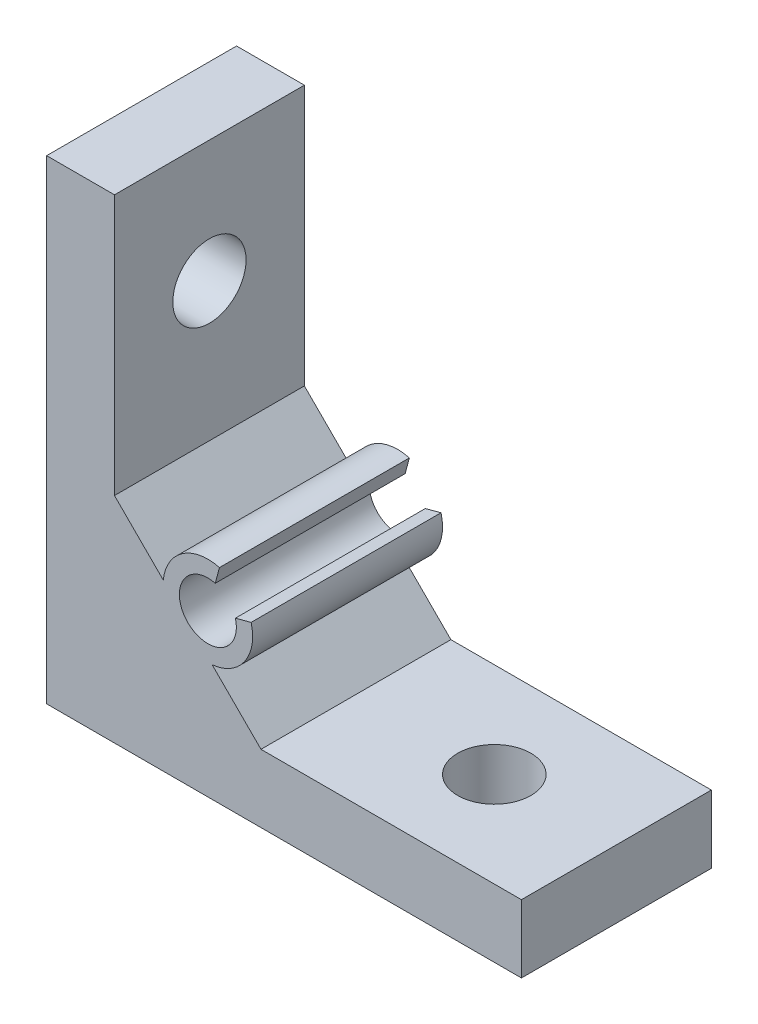
from build123d import *

# Parameters (mm, degrees)
BOSS_EXTRUDE1_DEPTH = 7
SKETCH3_R           = 2.7
CUT_EXTRUDE1_DEPTH  = 47.626172907
SKETCH4_R           = 2.7
CUT_EXTRUDE2_DEPTH  = 47.626172907


with BuildPart() as part:
    # Sketch1 → Boss-Extrude1 (new, symmetric)
    with BuildSketch(Plane.XY):
        with BuildLine():
            Line((0, 35), (0, 0))
            Line((0, 0), (35, 0))
            Line((35, 0), (35, 5))
            Line((35, 5), (15.8, 5))
            Line((15.8, 5), (12.2, 8.6))
            ThreePointArc((12.2, 8.6), (14.596011157, 10.003433414), (15.072479467, 12.739027089))
            Line((15.072479467, 12.739027089), (13.913368476, 12.428444235))
            ThreePointArc((13.913368476, 12.428444235), (10.4, 10.4), (12.428444235, 13.913368476))
            Line((12.428444235, 13.913368476), (12.739027089, 15.072479467))
            ThreePointArc((12.739027089, 15.072479467), (10.003433414, 14.596011157), (8.6, 12.2))
            Line((8.6, 12.2), (5, 15.8))
            Line((5, 15.8), (5, 35))
            Line((5, 35), (0, 35))
        make_face()
    extrude(amount=BOSS_EXTRUDE1_DEPTH, both=True)

    # Sketch3 → Cut-Extrude1 (cut, through all)
    with BuildSketch(Plane(origin=(0, 5, 0), x_dir=(1, 0, 0), z_dir=(0, 1, 0))):
        with Locations(Location((26, 0, 0), (0, 0, 180))):
            Circle(SKETCH3_R)
    extrude(amount=-CUT_EXTRUDE1_DEPTH, mode=Mode.SUBTRACT)

    # Sketch4 → Cut-Extrude2 (cut, through all)
    with BuildSketch(Plane(origin=(5, 0, 0), x_dir=(0, 0, -1), z_dir=(1, 0, 0))):
        with Locations((0, 26)):
            Circle(SKETCH4_R)
    extrude(amount=-CUT_EXTRUDE2_DEPTH, mode=Mode.SUBTRACT)


solid = part.part
